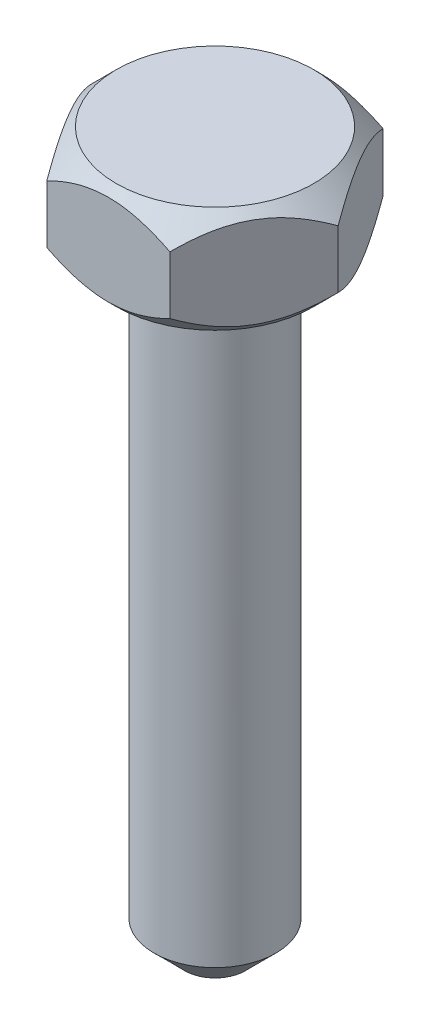
from build123d import *

# Parameters (mm, degrees)
EXTRUDE_1_DEPTH = 3.5
SKETCH_5_R      = 2
EXTRUDE_2_DEPTH = 20
CHAMFER_1_SIZE  = 1


with BuildPart() as part:
    # Эскиз1 → Вытянуть1 (new body)
    with BuildSketch(Plane(origin=(0, 0, 0), x_dir=(1, 0, 0), z_dir=(0, 1, 0))):
        Polygon((-2.020725942, 3.5), (2.020725942, 3.5), (4.041451884, 0), (2.020725942, -3.5), (-2.020725942, -3.5), (-4.041451884, 0), align=None)
    extrude(amount=-EXTRUDE_1_DEPTH)

    # Эскиз5 → Вытянуть2 (add)
    with BuildSketch(Plane.XZ.offset(3.5)):
        with Locations(Location((0, 0, 0), (0, 0, 90))):
            Circle(SKETCH_5_R)
    extrude(amount=EXTRUDE_2_DEPTH)

    # Фаска1
    chamfer_1_edges = [part.edges().sort_by_distance(p)[0] for p in [
        (0, -23.5, -2),
    ]]
    chamfer(chamfer_1_edges, length=CHAMFER_1_SIZE)

    # Эскиз4 → Вырез-Повернуть1 (revolve, cut)
    with BuildSketch(Plane.XY, mode=Mode.PRIVATE) as cut_revolve_1_sk:
        Polygon((-4.041451884, -0.8), (-3.241451884, 0), (-4.041451884, 0), align=None)
        Polygon((-4.041451884, -2.7), (-3.241451884, -3.5), (-4.041451884, -3.5), align=None)
    revolve(cut_revolve_1_sk.sketch.rotate(Axis((0, -3.5, 0), (0, -1, 0)), 120.000000136), axis=Axis((0, -3.5, 0), (0, -1, 0)), mode=Mode.SUBTRACT)


solid = part.part
